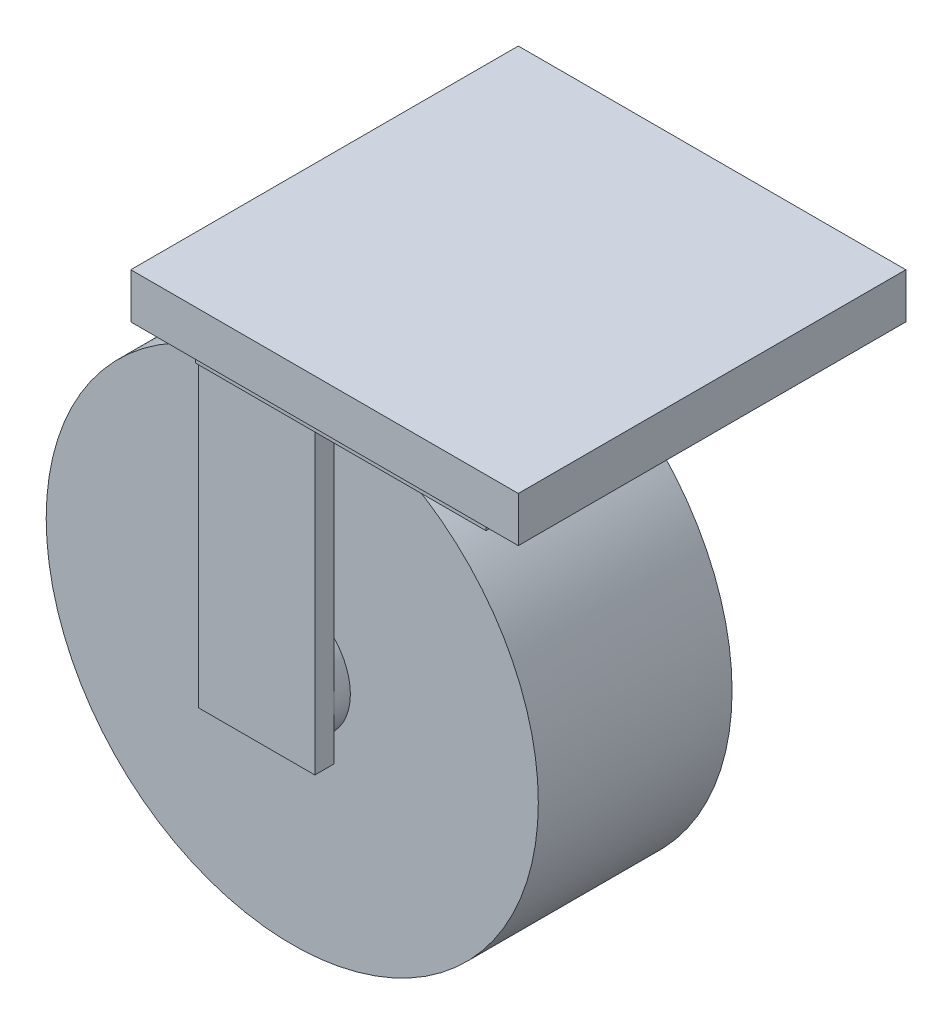
from build123d import *

# Parameters (mm, degrees)
P01_SPACER4MM_START  = 89
SK_P01_SPACER4MM_W   = 60
SK_P01_SPACER4MM_H   = 60
P01_SPACER4MM_DEPTH  = 4
P02_TOPPLATE_START   = 86
SK_P02_TOPPLATE_W    = 60
SK_P02_TOPPLATE_H    = 60
P02_TOPPLATE_DEPTH   = 3
P03_SWIVELRACE_START = 80
SK_P03_SWIVELRACE_R  = 22
P03_SWIVELRACE_DEPTH = 6
P04_FORKYOKE_START   = 76.5
SK_P04_FORKYOKE_W    = 45
SK_P04_FORKYOKE_H    = 42
P04_FORKYOKE_DEPTH   = 3.5
P05_FORKLEG_START    = 30
SK_P05_FORKLEG_W     = 18
SK_P05_FORKLEG_H     = 3
P05_FORKLEG_DEPTH    = 48
P06_FORKLEG_START    = 30
SK_P06_FORKLEG_W     = 18
SK_P06_FORKLEG_H     = 3
P06_FORKLEG_DEPTH    = 48
P07_WHEEL3IN_START   = -15
SK_P07_WHEEL3IN_R    = 38.1
P07_WHEEL3IN_DEPTH   = 30
P08_AXLE_START       = -17.5
SK_P08_AXLE_R        = 9
P08_AXLE_DEPTH       = 35


with BuildPart() as part:
    # SK_P01_Spacer4mm → P01_Spacer4mm (new body)
    with BuildSketch(Plane(origin=(0, 0, 0), x_dir=(1, 0, 0), z_dir=(0, 1, 0)).offset(P01_SPACER4MM_START)):
        with Locations((14.05, 0)):
            Rectangle(SK_P01_SPACER4MM_W, SK_P01_SPACER4MM_H)
    extrude(amount=P01_SPACER4MM_DEPTH)

    # SK_P02_Topplate → P02_Topplate (add)
    with BuildSketch(Plane(origin=(0, 0, 0), x_dir=(1, 0, 0), z_dir=(0, 1, 0)).offset(P02_TOPPLATE_START)):
        with Locations((14.05, 0)):
            Rectangle(SK_P02_TOPPLATE_W, SK_P02_TOPPLATE_H)
    extrude(amount=P02_TOPPLATE_DEPTH)

    # SK_P03_Swivelrace → P03_Swivelrace (add)
    with BuildSketch(Plane(origin=(0, 0, 0), x_dir=(1, 0, 0), z_dir=(0, 1, 0)).offset(P03_SWIVELRACE_START)):
        with Locations(Location((14.05, 0, 0), (0, 0, 270))):
            Circle(SK_P03_SWIVELRACE_R)
    extrude(amount=P03_SWIVELRACE_DEPTH)

    # SK_P04_Forkyoke → P04_Forkyoke (add)
    with BuildSketch(Plane(origin=(0, 0, 0), x_dir=(1, 0, 0), z_dir=(0, 1, 0)).offset(P04_FORKYOKE_START)):
        with Locations((7.55, 0)):
            Rectangle(SK_P04_FORKYOKE_W, SK_P04_FORKYOKE_H)
    extrude(amount=P04_FORKYOKE_DEPTH)

    # SK_P05_Forkleg → P05_Forkleg (add)
    with BuildSketch(Plane(origin=(0, 0, 0), x_dir=(1, 0, 0), z_dir=(0, 1, 0)).offset(P05_FORKLEG_START)):
        with Locations((-5.95, 19)):
            Rectangle(SK_P05_FORKLEG_W, SK_P05_FORKLEG_H)
    extrude(amount=P05_FORKLEG_DEPTH)

    # SK_P06_Forkleg → P06_Forkleg (add)
    with BuildSketch(Plane(origin=(0, 0, 0), x_dir=(1, 0, 0), z_dir=(0, 1, 0)).offset(P06_FORKLEG_START)):
        with Locations((-5.95, -19)):
            Rectangle(SK_P06_FORKLEG_W, SK_P06_FORKLEG_H)
    extrude(amount=P06_FORKLEG_DEPTH)



with BuildPart() as body_2:
    # SK_P07_Wheel3in → P07_Wheel3in (new body)
    with BuildSketch(Plane.XY.offset(P07_WHEEL3IN_START)):
        with Locations((-5.95, 38.1)):
            Circle(SK_P07_WHEEL3IN_R)
    extrude(amount=P07_WHEEL3IN_DEPTH)


with BuildPart() as part_1:
    add(part.part)

    add(body_2.part)  # P08_Axle merges body 2
    # SK_P08_Axle → P08_Axle (add)
    with BuildSketch(Plane.XY.offset(P08_AXLE_START)):
        with Locations((-5.95, 38.1)):
            Circle(SK_P08_AXLE_R)
    extrude(amount=P08_AXLE_DEPTH)


solid = part_1.part
